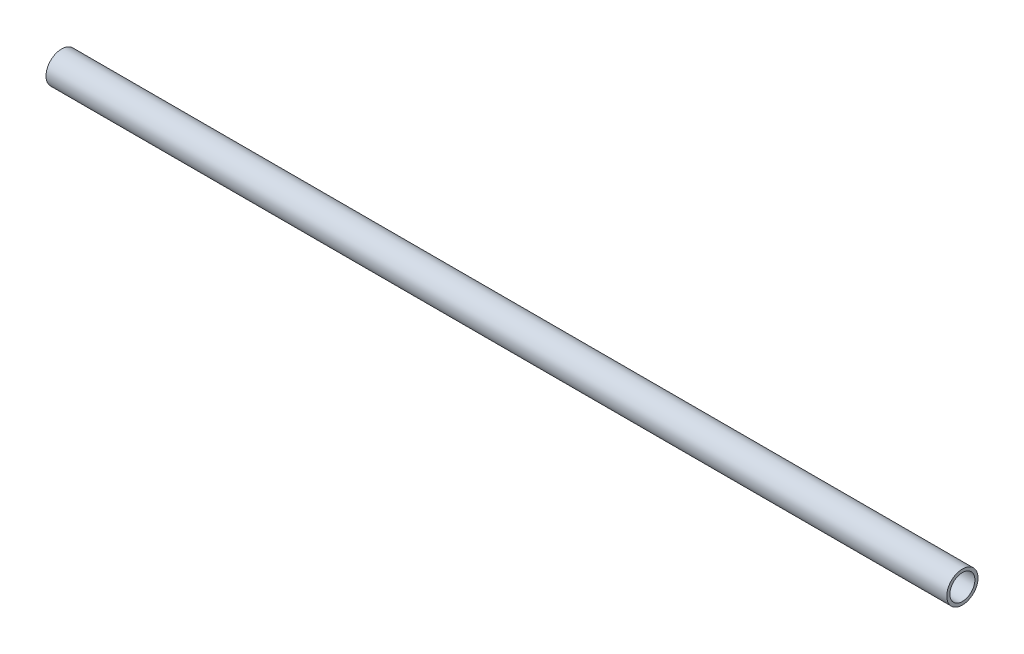
from build123d import *

# Parameters (mm, degrees)
SKETCH1_W = 914.4
SKETCH1_H = 3.175


with BuildPart() as part:
    # Sketch1 → Revolve1 (revolve)
    with BuildSketch(Plane.XY, mode=Mode.PRIVATE) as revolve1_sk:
        with Locations((0, 14.2875)):
            Rectangle(SKETCH1_W, SKETCH1_H)
    revolve(revolve1_sk.sketch.rotate(Axis((-444.782693128, 0, 0), (1, 0, 0)), 90), axis=Axis((-444.782693128, 0, 0), (1, 0, 0)))


solid = part.part
